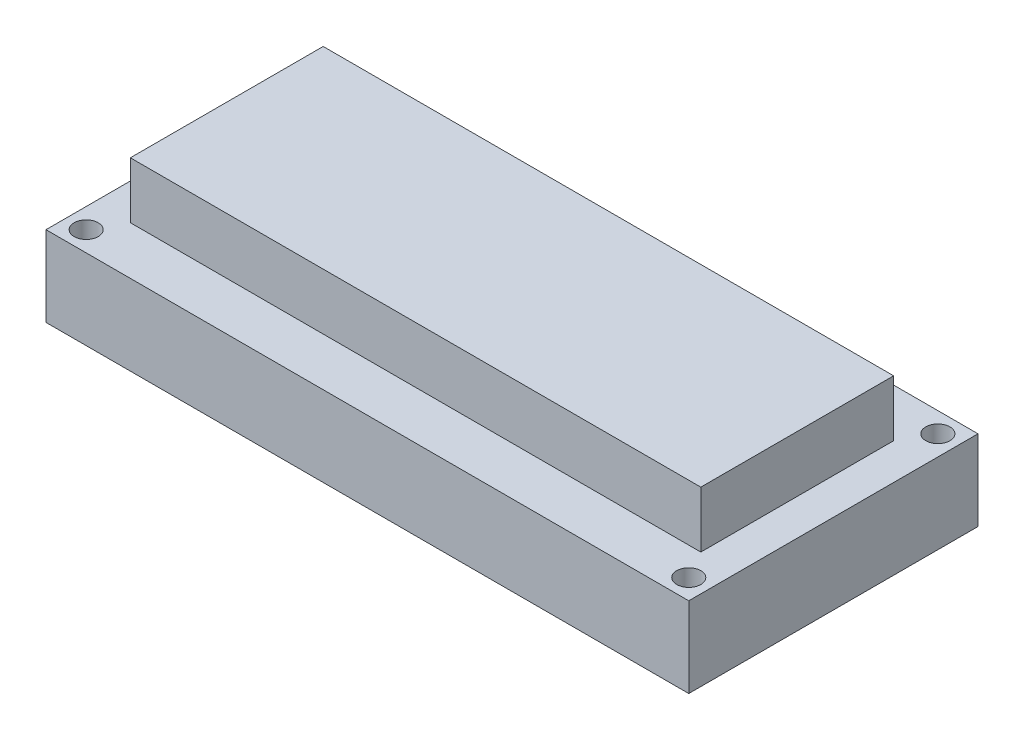
from build123d import *

# Parameters (mm, degrees)
SKETCH1_W           = 80
SKETCH1_H           = 36
SKETCH1_R           = 1.5
BOSS_EXTRUDE1_DEPTH = 10
SKETCH1_3_W         = 71
SKETCH1_3_H         = 24
BOSS_EXTRUDE2_DEPTH = 7
BOSS_EXTRUDE3_DEPTH = 3


with BuildPart() as part:
    # Sketch1 → Boss-Extrude1 (new body)
    with BuildSketch(Plane(origin=(0, 0, 0), x_dir=(1, 0, 0), z_dir=(0, 1, 0))):
        Rectangle(SKETCH1_W, SKETCH1_H)
        with Locations((-37.5, -15.5)):
            Circle(SKETCH1_R, mode=Mode.SUBTRACT)
        with Locations((37.5, -15.5)):
            Circle(SKETCH1_R, mode=Mode.SUBTRACT)
        with Locations((-37.5, 15.5)):
            Circle(SKETCH1_R, mode=Mode.SUBTRACT)
        with Locations((37.5, 15.5)):
            Circle(SKETCH1_R, mode=Mode.SUBTRACT)
    extrude(amount=-BOSS_EXTRUDE1_DEPTH)

    # Sketch1<3> → Boss-Extrude2 (add)
    with BuildSketch(Plane(origin=(0, 0, 0), x_dir=(1, 0, 0), z_dir=(0, 1, 0))):
        Rectangle(SKETCH1_3_W, SKETCH1_3_H)
    extrude(amount=BOSS_EXTRUDE2_DEPTH)

    # Sketch2 → Boss-Extrude3 (add)
    with BuildSketch(Plane(origin=(0, 0, 0), x_dir=(1, 0, 0), z_dir=(0, 1, 0))):
        Polygon((-38.5, -1.5), (-35.5, -4), (-35.5, 4), (-38.5, 1.5), align=None)
    extrude(amount=BOSS_EXTRUDE3_DEPTH)


solid = part.part
